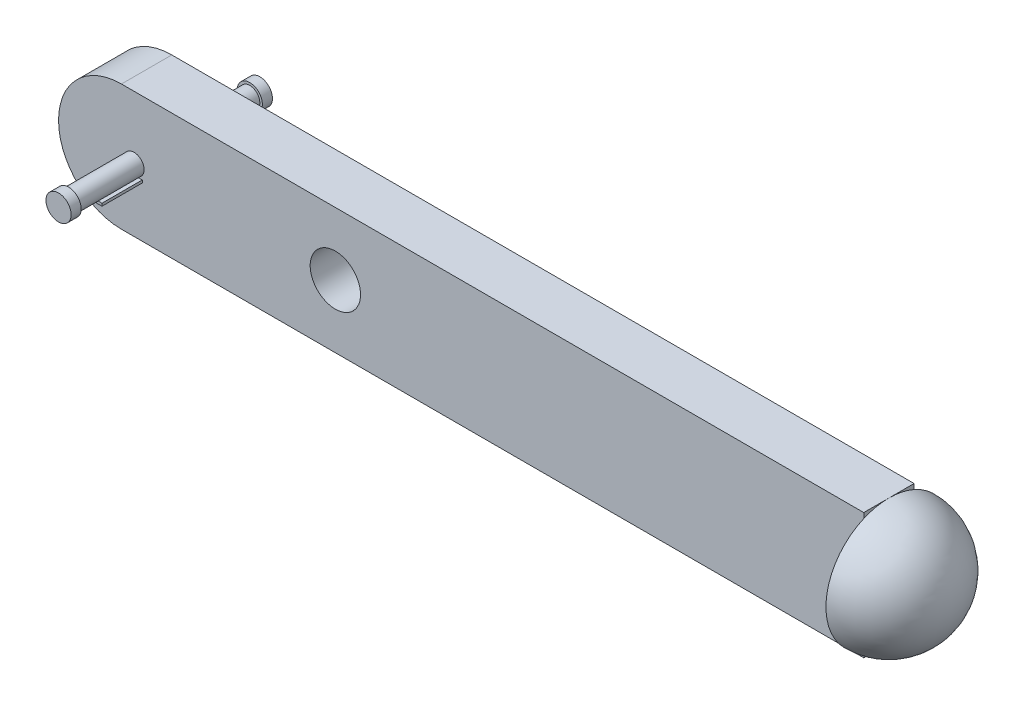
from build123d import *

# Parameters (mm, degrees)
SKETCH1_R                = 6.35
BOSS_EXTRUDE1_DEPTH      = 12.7
BOSS_EXTRUDE2_DEPTH      = 19.05
BOSS_EXTRUDE2_DEPTH_BACK = 31.75
SKETCH2_R                = 3.175
CUT_EXTRUDE1_START       = -2.54
SKETCH3_OUTSIDE_W        = 247.57
SKETCH3_OUTSIDE_H        = 76.12
SKETCH3_OUTSIDE_R        = 2.54
CUT_EXTRUDE1_DEPTH       = 16.51
CUT_EXTRUDE2_START       = -2.54
SKETCH4_OUTSIDE_W        = 247.57
SKETCH4_OUTSIDE_H        = 76.12
SKETCH4_OUTSIDE_R        = 2.54
CUT_EXTRUDE2_DEPTH       = 16.51
REVOLVE1_ANGLE           = 180
SKETCH9_W                = 4.061831886
SKETCH9_H                = 0.660529679
BOSS_EXTRUDE4_DEPTH      = 10.16


with BuildPart() as part:
    # Sketch1 → Boss-Extrude1 (new body)
    with BuildSketch(Plane.XY):
        with BuildLine():
            Line((16.512967167, -9.984929936), (16.512967167, -41.734929936))
            Line((16.512967167, -41.734929936), (-170.812032833, -41.734929936))
            ThreePointArc((-170.812032833, -41.734929936), (-186.687032833, -25.859929936), (-170.812032833, -9.984929936))
            Line((-170.812032833, -9.984929936), (16.512967167, -9.984929936))
        make_face()
        with Locations((-116.837032833, -25.859929936)):
            Circle(SKETCH1_R, mode=Mode.SUBTRACT)
    extrude(amount=BOSS_EXTRUDE1_DEPTH)

    # Sketch2 → Boss-Extrude2 (add, two sides: drawn at the far end of the back side and taken through both)
    with BuildSketch(Plane.XY.offset(12.7).offset(-BOSS_EXTRUDE2_DEPTH_BACK)):
        with Locations((-167.637032833, -25.859929936)):
            Circle(SKETCH2_R)
    extrude(amount=BOSS_EXTRUDE2_DEPTH + BOSS_EXTRUDE2_DEPTH_BACK)

    # Sketch3 outside → Cut-Extrude1 (cut)
    with BuildSketch(Plane.XY.offset(31.75).offset(CUT_EXTRUDE1_START)):
        with Locations((-85.087, -25.86)):
            Rectangle(SKETCH3_OUTSIDE_W, SKETCH3_OUTSIDE_H)
        with Locations((-167.637032833, -25.859929936)):
            Circle(SKETCH3_OUTSIDE_R, mode=Mode.SUBTRACT)
    extrude(amount=-CUT_EXTRUDE1_DEPTH, mode=Mode.SUBTRACT)

    # Sketch4 outside → Cut-Extrude2 (cut)
    with BuildSketch(Plane(origin=(0, 0, -19.05), x_dir=(-1, 0, 0), z_dir=(0, 0, -1)).offset(CUT_EXTRUDE2_START)):
        with Locations((85.087, -25.86)):
            Rectangle(SKETCH4_OUTSIDE_W, SKETCH4_OUTSIDE_H)
        with Locations(Location((167.637032833, -25.859929936, 0), (0, 0, 180))):
            Circle(SKETCH4_OUTSIDE_R, mode=Mode.SUBTRACT)
    extrude(amount=-CUT_EXTRUDE2_DEPTH, mode=Mode.SUBTRACT)

    # Sketch6 → Revolve1 (revolve)
    with BuildSketch(Plane(origin=(16.512967167, 0, 0), x_dir=(0, 0, -1), z_dir=(1, 0, 0))):
        with BuildLine():
            Line((-6.35, -9.984929936), (-6.35, -41.734929936))
            ThreePointArc((-6.35, -41.734929936), (-22.245527261, -25.859929936), (-6.35, -9.984929936))
        make_face()
    revolve(axis=Axis((16.512967167, -9.984929936, 6.35), (0, 1, 0)), revolution_arc=REVOLVE1_ANGLE)

    # Sketch9 → Boss-Extrude4 (add)
    with BuildSketch(Plane.XY.offset(12.7)):
        with Locations((-167.595763161, -28.664448748)):
            Rectangle(SKETCH9_W, SKETCH9_H)
    extrude(amount=BOSS_EXTRUDE4_DEPTH)


solid = part.part
